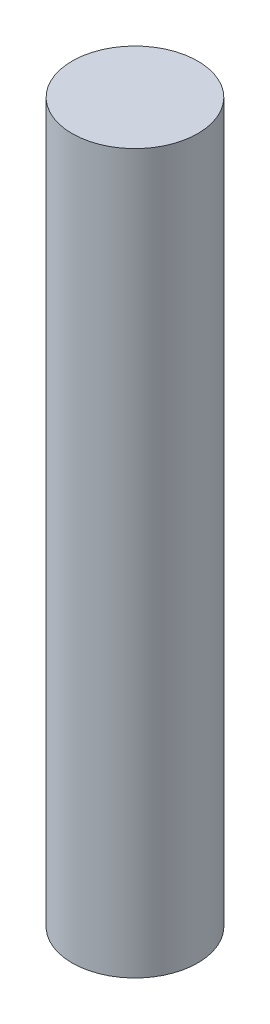
from build123d import *

# Parameters (mm, degrees)
SKETCH1_R           = 3.5
BOSS_EXTRUDE1_DEPTH = 40


with BuildPart() as part:
    # Sketch1 → Boss-Extrude1 (new body)
    with BuildSketch(Plane(origin=(0, 0, 0), x_dir=(1, 0, 0), z_dir=(0, 1, 0))):
        with Locations(Location((0, 0, 0), (0, 0, 270))):
            Circle(SKETCH1_R)
    extrude(amount=BOSS_EXTRUDE1_DEPTH)


solid = part.part
